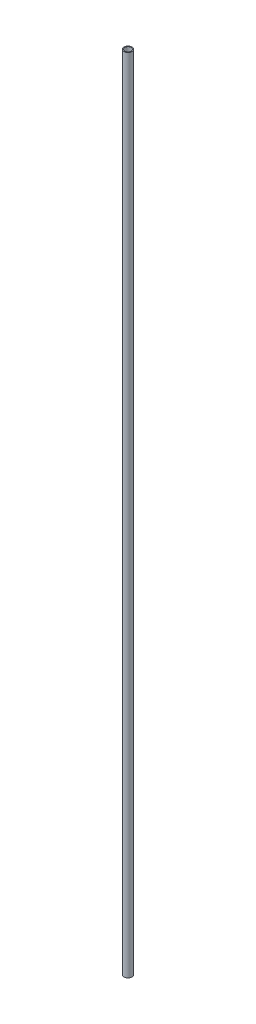
from build123d import *

# Parameters (mm, degrees)
SKETCH1_R           = 5
SKETCH1_R_2         = 4
BOSS_EXTRUDE1_DEPTH = 1000


with BuildPart() as part:
    # Sketch1 → Boss-Extrude1 (new body)
    with BuildSketch(Plane(origin=(0, 0, 0), x_dir=(1, 0, 0), z_dir=(0, 1, 0))):
        with Locations(Location((0, 0, 0), (0, 0, 270))):
            Circle(SKETCH1_R)
        with Locations(Location((0, 0, 0), (0, 0, 270))):
            Circle(SKETCH1_R_2, mode=Mode.SUBTRACT)
    extrude(amount=-BOSS_EXTRUDE1_DEPTH)


solid = part.part
